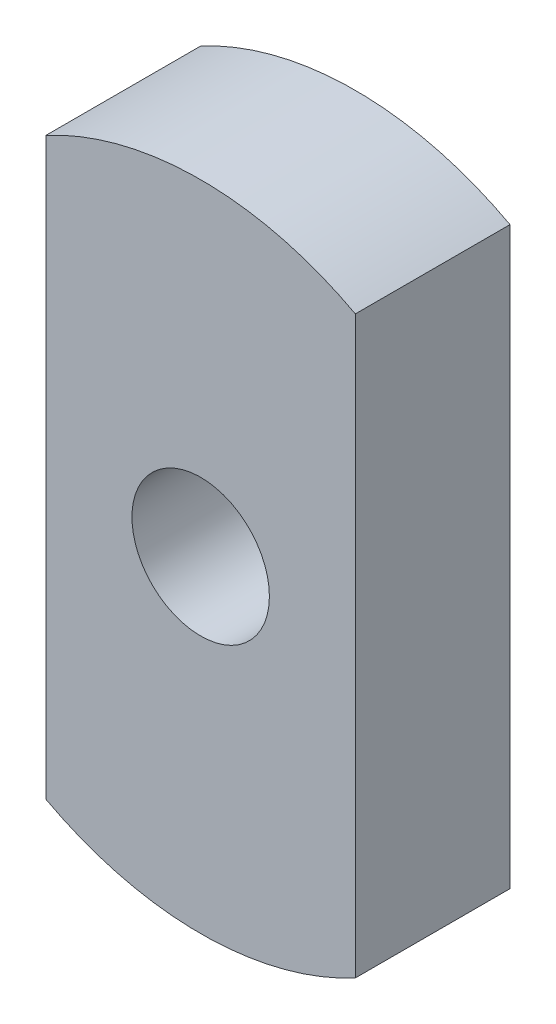
from build123d import *

# Parameters (mm, degrees)
SKETCH1_R           = 2
BOSS_EXTRUDE1_DEPTH = 4.5


with BuildPart() as part:
    # Sketch1 → Boss-Extrude1 (new body)
    with BuildSketch(Plane.XY):
        with BuildLine():
            Line((-4.5, 8.366600265), (-4.5, -8.366600265))
            ThreePointArc((-4.5, -8.366600265), (0, -9.5), (4.5, -8.366600265))
            Line((4.5, -8.366600265), (4.5, 8.366600265))
            ThreePointArc((4.5, 8.366600265), (0, 9.5), (-4.5, 8.366600265))
        make_face()
        Circle(SKETCH1_R, mode=Mode.SUBTRACT)
    extrude(amount=BOSS_EXTRUDE1_DEPTH)


solid = part.part
